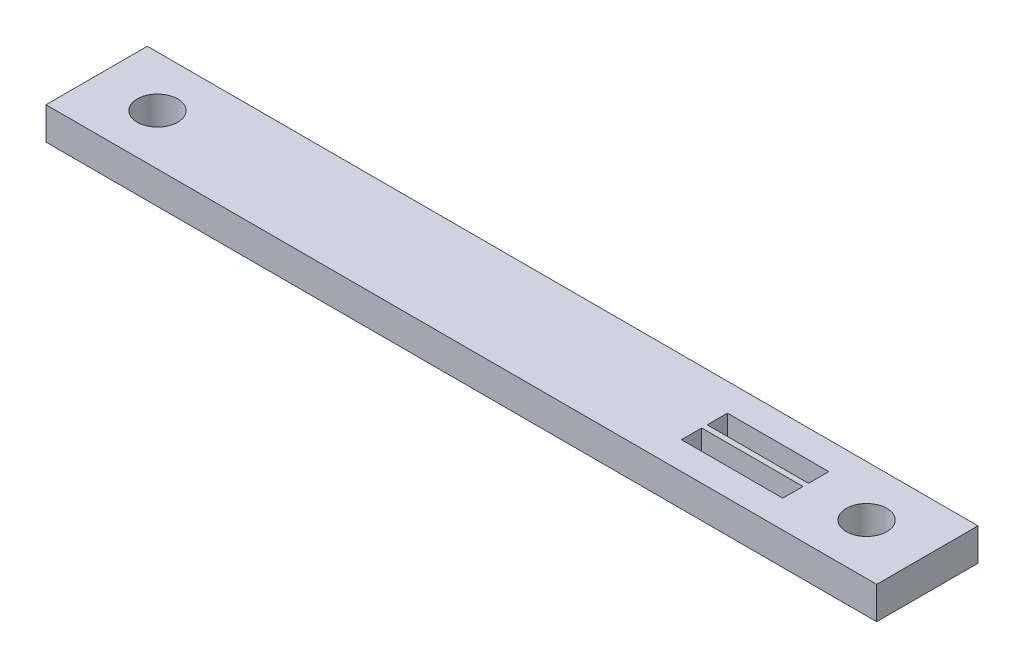
from build123d import *

# Parameters (mm, degrees)
SKETCH1_W           = 41
SKETCH1_H           = 5
SKETCH1_W_2         = 5
SKETCH1_H_2         = 1
SKETCH1_R           = 1
BOSS_EXTRUDE1_DEPTH = 1.6


with BuildPart() as part:
    # Sketch1 → Boss-Extrude1 (new body)
    with BuildSketch(Plane(origin=(0, 0, 0), x_dir=(1, 0, 0), z_dir=(0, 1, 0))):
        with Locations((13.5, 0)):
            Rectangle(SKETCH1_W, SKETCH1_H)
        with Locations((25.5, -0.635)):
            Rectangle(SKETCH1_W_2, SKETCH1_H_2, mode=Mode.SUBTRACT)
        with Locations(Location((-4, 0, 0), (0, 0, 270))):
            Circle(SKETCH1_R, mode=Mode.SUBTRACT)
        with Locations(Location((31, 0, 0), (0, 0, 270))):
            Circle(SKETCH1_R, mode=Mode.SUBTRACT)
        with Locations((25.5, 0.635)):
            Rectangle(SKETCH1_W_2, SKETCH1_H_2, mode=Mode.SUBTRACT)
    extrude(amount=BOSS_EXTRUDE1_DEPTH)


solid = part.part
